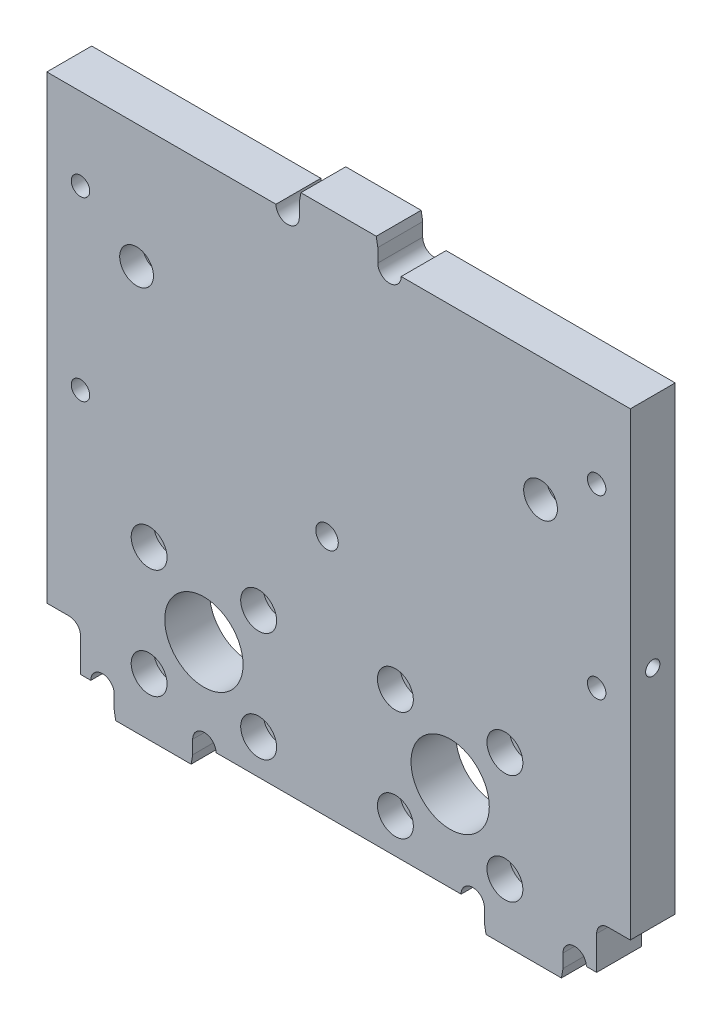
from build123d import *

# Parameters (mm, degrees)
SKETCH1_W                       = 165.1
SKETCH1_H                       = 142.875
BOSS_EXTRUDE1_DEPTH             = 12.7
BOSS_EXTRUDE2_DEPTH             = 12.7
CUT_EXTRUDE1_REACH              = 116.135
BOSS_EXTRUDE3_DEPTH             = 12.7
F_21_0_159_DIAMETER_HOLE2_D     = 4.0386
F_21_0_159_DIAMETER_HOLE2_DEPTH = 22.225
F_21_0_159_DIAMETER_HOLE2_TIP   = 1.213317848
F_21_0_159_DIAMETER_HOLE3_D     = 4.0386
F_21_0_159_DIAMETER_HOLE3_DEPTH = 22.225
F_21_0_159_DIAMETER_HOLE3_TIP   = 1.213317848
CUT_EXTRUDE2_DEPTH              = 12.7
SKETCH21_R                      = 5.08
SKETCH21_R_2                    = 4.7752
SKETCH21_R_3                    = 11.075399998
SKETCH21_R_4                    = 3.1877
CUT_EXTRUDE10_DEPTH             = 6.35
F_8_CLEARANCE_HOLE1_D           = 4.4958
F_8_CLEARANCE_HOLE1_DEPTH       = 19.05
F_8_CLEARANCE_HOLE1_TIP         = 1.350674586
M3_CLEARANCE_HOLE1_D            = 3.4
M3_CLEARANCE_HOLE1_DEPTH        = 19.05
M3_CLEARANCE_HOLE1_TIP          = 1.021463052
SKETCH28_R                      = 11.075399998
CUT_EXTRUDE11_DEPTH             = 12.7
SKETCH29_W                      = 9.525
SKETCH29_H                      = 12.7
CUT_EXTRUDE12_DEPTH             = 115.134515622
FILLET1_R                       = 3.175
F_5_0_2055_DIAMETER_HOLE1_D     = 5.2197


with BuildPart() as part:
    # Sketch1 → Boss-Extrude1 (new body)
    with BuildSketch(Plane.XY):
        Rectangle(SKETCH1_W, SKETCH1_H)
    extrude(amount=BOSS_EXTRUDE1_DEPTH)

    # Sketch2 → Boss-Extrude2 (add)
    with BuildSketch(Plane.XY.offset(12.7)):
        Polygon((-11.1125, 71.4375), (11.1125, 71.4375), (11.1125, 75.2475), (10.664629469, 77.7875), (-10.664629469, 77.7875), (-11.1125, 75.2475), align=None)
    extrude(amount=-BOSS_EXTRUDE2_DEPTH)

    # Sketch4 → Cut-Extrude1 (cut, up to next)
    with BuildSketch(Plane.XY.offset(12.7), mode=Mode.PRIVATE) as cut_extrude1_sk1:
        with BuildLine():
            Line((-17.7165, 71.4375), (-11.1125, 71.4375))
            ThreePointArc((-11.1125, 71.4375), (-14.4145, 68.1355), (-17.7165, 71.4375))
        make_face()
    cut_extrude1_tool1 = extrude(cut_extrude1_sk1.sketch, amount=-CUT_EXTRUDE1_REACH, mode=Mode.PRIVATE) & part.part
    # Sketch4 → Cut-Extrude1 (cut, up to next)
    with BuildSketch(Plane.XY.offset(12.7), mode=Mode.PRIVATE) as cut_extrude1_sk2:
        with BuildLine():
            Line((11.1125, 71.4375), (17.7165, 71.4375))
            ThreePointArc((17.7165, 71.4375), (14.4145, 68.1355), (11.1125, 71.4375))
        make_face()
    cut_extrude1_tool2 = extrude(cut_extrude1_sk2.sketch, amount=-CUT_EXTRUDE1_REACH, mode=Mode.PRIVATE) & part.part
    add(cut_extrude1_tool1.solids().sort_by_distance((-14.4145, 70.036088, 12.7))[0], mode=Mode.SUBTRACT)
    add(cut_extrude1_tool2.solids().sort_by_distance((14.4145, 70.036088, 12.7))[0], mode=Mode.SUBTRACT)

    # Sketch5 → Boss-Extrude3 (add)
    with BuildSketch(Plane.XY.offset(12.7)):
        Polygon((63.5, -71.4375), (41.275, -71.4375), (41.275, -75.2475), (41.722870531, -77.7875), (63.052129469, -77.7875), (63.5, -75.2475), align=None)
    boss_extrude3 = extrude(amount=-BOSS_EXTRUDE3_DEPTH)

    # #21 (0.159) Diameter Hole2
    with Locations(Plane(origin=(82.55, 0, 0), x_dir=(0, 0, -1), z_dir=(1, 0, 0))):
        with Locations((-6.35, 4.7625)):
            Hole(F_21_0_159_DIAMETER_HOLE2_D / 2, depth=F_21_0_159_DIAMETER_HOLE2_DEPTH)
            with Locations((0, 0, -(F_21_0_159_DIAMETER_HOLE2_DEPTH + F_21_0_159_DIAMETER_HOLE2_TIP / 2))):  # 118° drill point
                Cone(0, F_21_0_159_DIAMETER_HOLE2_D / 2, F_21_0_159_DIAMETER_HOLE2_TIP, mode=Mode.SUBTRACT)

    # #21 (0.159) Diameter Hole3
    with Locations(Plane.ZY.offset(82.55)):
        with Locations((6.35, 4.7625)):
            Hole(F_21_0_159_DIAMETER_HOLE3_D / 2, depth=F_21_0_159_DIAMETER_HOLE3_DEPTH)
            with Locations((0, 0, -(F_21_0_159_DIAMETER_HOLE3_DEPTH + F_21_0_159_DIAMETER_HOLE3_TIP / 2))):  # 118° drill point
                Cone(0, F_21_0_159_DIAMETER_HOLE3_D / 2, F_21_0_159_DIAMETER_HOLE3_TIP, mode=Mode.SUBTRACT)

    # Sketch6 → Cut-Extrude2 (cut)
    with BuildSketch(Plane.XY.offset(12.7)):
        with BuildLine():
            Line((34.671, -71.4375), (41.275, -71.4375))
            ThreePointArc((41.275, -71.4375), (37.973, -68.1355), (34.671, -71.4375))
        make_face()
        with BuildLine():
            Line((63.5, -71.4375), (70.104, -71.4375))
            ThreePointArc((70.104, -71.4375), (66.802, -68.1355), (63.5, -71.4375))
        make_face()
    cut_extrude2 = extrude(amount=-CUT_EXTRUDE2_DEPTH, mode=Mode.SUBTRACT)

    # Mirror1: Boss-Extrude3, Cut-Extrude2 across plane
    add(boss_extrude3.mirror(Plane(origin=(0, 0, 0), x_dir=(0, 0, 1), z_dir=(1, 0, 0))))
    add(cut_extrude2.mirror(Plane(origin=(0, 0, 0), x_dir=(0, 0, 1), z_dir=(1, 0, 0))), mode=Mode.SUBTRACT)

    # Sketch21 → Cut-Extrude10 (cut)
    with BuildSketch(Plane.XY.offset(12.7)):
        with Locations((-53.594, -61.5315)):
            Circle(SKETCH21_R)
        with Locations((-57.15, 36.5125)):
            Circle(SKETCH21_R_2)
        with Locations((-53.594, -30.5435)):
            Circle(SKETCH21_R)
        with Locations((-22.606, -30.5435)):
            Circle(SKETCH21_R)
        with Locations((-22.606, -61.5315)):
            Circle(SKETCH21_R)
        with Locations((-38.1, -46.0375)):
            Circle(SKETCH21_R_3)
        with Locations((-3.263048163, -2.752650538)):
            Circle(SKETCH21_R_4)
        with Locations((31.573903673, -46.0375)):
            Circle(SKETCH21_R_3)
        with Locations((16.079903673, -30.5435)):
            Circle(SKETCH21_R)
        with Locations((47.067903673, -30.5435)):
            Circle(SKETCH21_R)
        with Locations((47.067903673, -61.5315)):
            Circle(SKETCH21_R)
        with Locations((16.079903673, -61.5315)):
            Circle(SKETCH21_R)
        with Locations((57.15, 36.5125)):
            Circle(SKETCH21_R_2)
    extrude(amount=-CUT_EXTRUDE10_DEPTH, mode=Mode.SUBTRACT)

    # #8 Clearance Hole1
    with Locations(Plane.XY.offset(12.7)):
        with Locations((-57.15, 36.5125), (57.15, 36.5125), (-3.263048163, -2.752650538)):
            Hole(F_8_CLEARANCE_HOLE1_D / 2, depth=F_8_CLEARANCE_HOLE1_DEPTH)
            with Locations((0, 0, -(F_8_CLEARANCE_HOLE1_DEPTH + F_8_CLEARANCE_HOLE1_TIP / 2))):  # 118° drill point
                Cone(0, F_8_CLEARANCE_HOLE1_D / 2, F_8_CLEARANCE_HOLE1_TIP, mode=Mode.SUBTRACT)

    # M3 Clearance Hole1
    with Locations(Plane.XY.offset(12.7)):
        with Locations((-53.594, -30.5435), (-22.606, -30.5435), (-22.606, -61.5315), (-53.594, -61.5315), (16.079903673, -61.5315), (16.079903673, -30.5435), (47.067903673, -30.5435), (47.067903673, -61.5315)):
            Hole(M3_CLEARANCE_HOLE1_D / 2, depth=M3_CLEARANCE_HOLE1_DEPTH)
            with Locations((0, 0, -(M3_CLEARANCE_HOLE1_DEPTH + M3_CLEARANCE_HOLE1_TIP / 2))):  # 118° drill point
                Cone(0, M3_CLEARANCE_HOLE1_D / 2, M3_CLEARANCE_HOLE1_TIP, mode=Mode.SUBTRACT)

    # Sketch28 → Cut-Extrude11 (cut)
    with BuildSketch(Plane.XY.offset(12.7)):
        with Locations((31.573903673, -46.0375)):
            Circle(SKETCH28_R)
        with Locations((-38.1, -46.0375)):
            Circle(SKETCH28_R)
    extrude(amount=-CUT_EXTRUDE11_DEPTH, mode=Mode.SUBTRACT)

    # Sketch29 → Cut-Extrude12 (cut, through all)
    with BuildSketch(Plane.XY.offset(12.7)):
        with Locations((-77.7875, -65.0875)):
            Rectangle(SKETCH29_W, SKETCH29_H)
        with Locations((77.7875, -65.0875)):
            Rectangle(SKETCH29_W, SKETCH29_H)
    extrude(amount=-CUT_EXTRUDE12_DEPTH, mode=Mode.SUBTRACT)

    # Fillet1
    fillet1_edges = [part.edges().sort_by_distance(p)[0] for p in [
        (-73.025, -58.7375, 6.35),
        (73.025, -58.7375, 6.35),
    ]]
    fillet(fillet1_edges, radius=FILLET1_R)

    # #5 (0.2055) Diameter Hole1 (through all)
    with Locations(Plane(origin=(0, 0, 0), x_dir=(-1, 0, 0), z_dir=(0, 0, -1))):
        with Locations((-73.025, 48.26), (73.025, 48.26), (73.025, -1.740000076), (-73.025, -1.740000076)):
            Hole(F_5_0_2055_DIAMETER_HOLE1_D / 2)


solid = part.part
